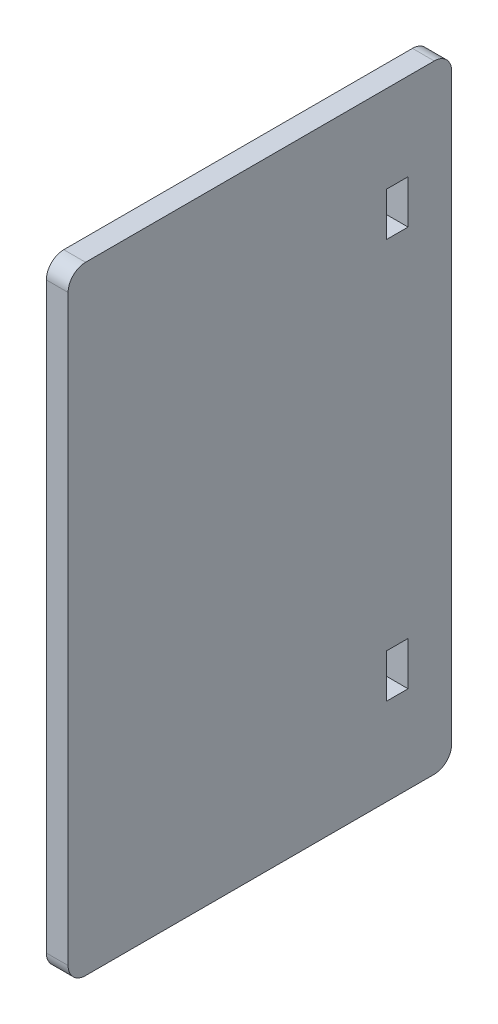
from build123d import *

# Parameters (mm, degrees)
SKETCH1_W           = 55.875
SKETCH1_H           = 90
BOSS_EXTRUDE1_DEPTH = 3.175
SKETCH2_W           = 3.175
SKETCH2_H           = 6.35
CUT_EXTRUDE1_DEPTH  = 54.062081859
FILLET1_R           = 2.54


with BuildPart() as part:
    # Sketch1 → Boss-Extrude1 (new body)
    with BuildSketch(Plane(origin=(0, 0, 0), x_dir=(0, 0, -1), z_dir=(1, 0, 0))):
        Rectangle(SKETCH1_W, SKETCH1_H)
    extrude(amount=BOSS_EXTRUDE1_DEPTH)

    # Sketch2 → Cut-Extrude1 (cut, through all)
    with BuildSketch(Plane(origin=(3.175, 0, 0), x_dir=(0, 0, -1), z_dir=(1, 0, 0))):
        with Locations((20, 29.125)):
            Rectangle(SKETCH2_W, SKETCH2_H)
        with Locations((20, -29.125)):
            Rectangle(SKETCH2_W, SKETCH2_H)
    extrude(amount=-CUT_EXTRUDE1_DEPTH, mode=Mode.SUBTRACT)

    # Fillet1
    fillet1_edges = [part.edges().sort_by_distance(p)[0] for p in [
        (1.5875, 45, 27.9375),
        (1.5875, 45, -27.9375),
        (1.5875, -45, -27.9375),
        (1.5875, -45, 27.9375),
    ]]
    fillet(fillet1_edges, radius=FILLET1_R)


solid = part.part
